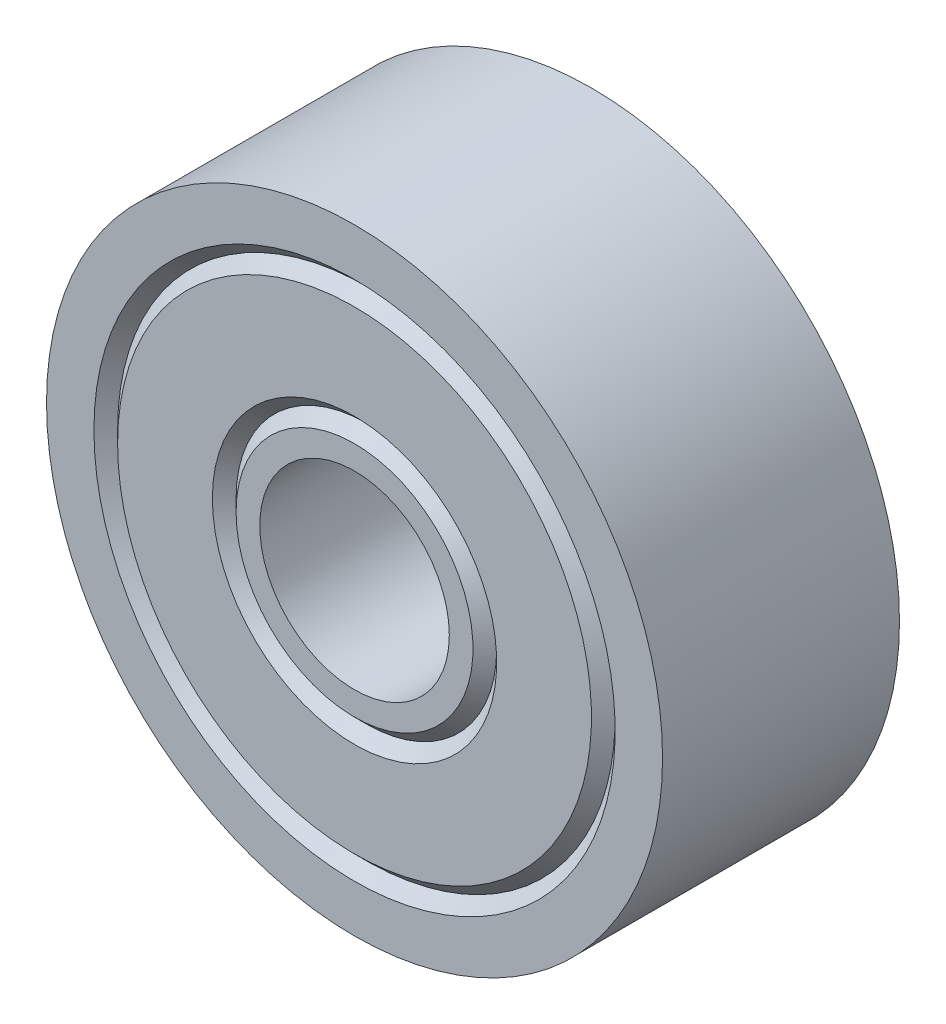
from build123d import *

# Parameters (mm, degrees)
SKETCH1_R           = 6.5
SKETCH1_R_2         = 2
BOSS_EXTRUDE1_DEPTH = 5


with BuildPart() as part:
    # Sketch1 → Boss-Extrude1 (new body)
    with BuildSketch(Plane.XY):
        Circle(SKETCH1_R)
        Circle(SKETCH1_R_2, mode=Mode.SUBTRACT)
    extrude(amount=BOSS_EXTRUDE1_DEPTH)

    # Sketch2 → Cut-Revolve1 (revolve, cut)
    with BuildSketch(Plane(origin=(0, 0, 0), x_dir=(0, 0, -1), z_dir=(1, 0, 0)), mode=Mode.PRIVATE) as cut_revolve1_sk:
        Polygon((-5, 5.5), (-5, 5), (-4.75, 5.25), align=None)
        Polygon((-5, 3), (-5, 2.5), (-4.75, 2.75), align=None)
        Polygon((-0.25, 2.75), (0, 3), (0, 2.5), align=None)
        Polygon((-0.25, 5.25), (0, 5.5), (0, 5), align=None)
    revolve(cut_revolve1_sk.sketch.rotate(Axis((0, 0, 0), (0, 0, 1)), 90), axis=Axis((0, 0, 0), (0, 0, 1)), mode=Mode.SUBTRACT)


solid = part.part
